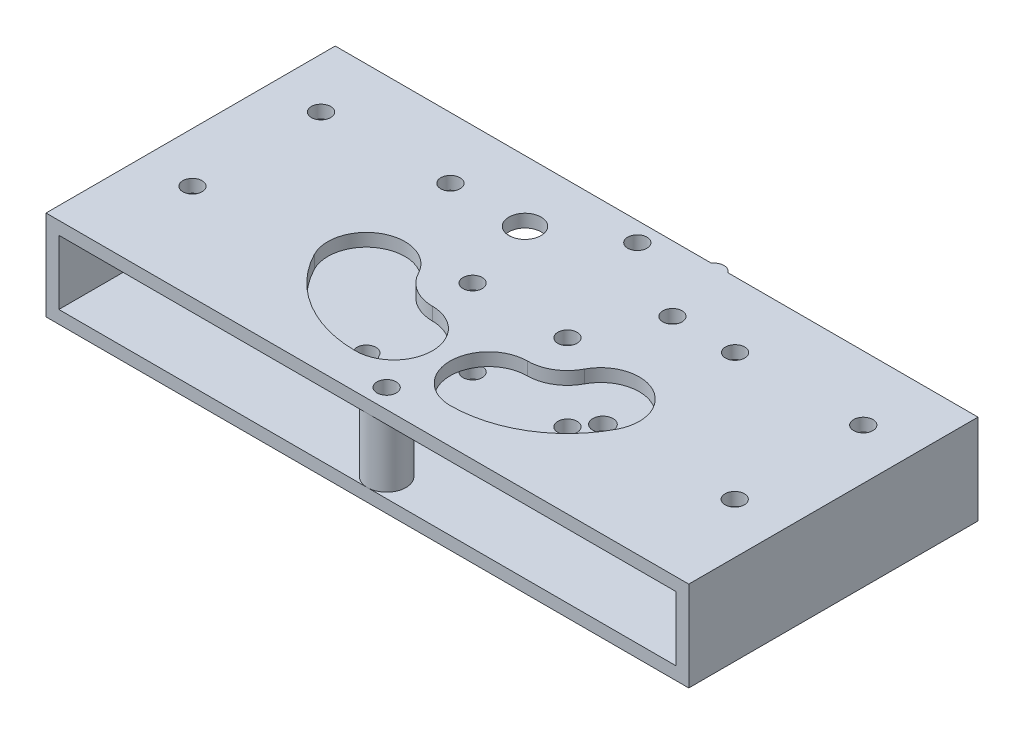
from build123d import *

# Parameters (mm, degrees)
SKETCH2_W           = 100
SKETCH2_H           = 40
BOSS_EXTRUDE5_DEPTH = 14
SHELL1_T            = -2
SKETCH3_6_R         = 2.5
SKETCH3_6_R_2       = 1.5
CUT_EXTRUDE8_DEPTH  = 56.641710973
CUT_EXTRUDE9_DEPTH  = 12
SKETCH5_W           = 100
SKETCH5_H           = 14
SKETCH5_W_2         = 96
SKETCH5_H_2         = 10
BOSS_EXTRUDE6_DEPTH = 5
SKETCH6_R           = 3
SKETCH6_R_2         = 1.5
SKETCH6_R_3         = 1.58
SKETCH6_R_4         = 1.95
BOSS_EXTRUDE7_DEPTH = 14
SKETCH6_2_R         = 1.5
CUT_EXTRUDE11_DEPTH = 58.628118137
CUT_EXTRUDE12_START = -2
SKETCH6_3_R         = 1.58
SKETCH6_3_R_2       = 1.95
CUT_EXTRUDE12_DEPTH = 56.628118137


with BuildPart() as part:
    # Sketch2 → Boss-Extrude5 (new body)
    with BuildSketch(Plane(origin=(0, 0, 0), x_dir=(1, 0, 0), z_dir=(0, 1, 0))):
        Rectangle(SKETCH2_W, SKETCH2_H)
    extrude(amount=BOSS_EXTRUDE5_DEPTH)

    # Shell1
    shell1_openings = [part.faces().sort_by_distance(p)[0] for p in [
        (0, 7, -20),
        (0, 7, 20),
    ]]
    offset(amount=SHELL1_T, openings=shell1_openings, kind=Kind.INTERSECTION)

    # Sketch3<6> → Cut-Extrude8 (cut, through all)
    with BuildSketch(Plane(origin=(0, 14, 0), x_dir=(1, 0, 0), z_dir=(0, 1, 0))):
        with Locations(Location((-10.944299399, 10.466797681, 0), (0, 0, 270))):
            Circle(SKETCH3_6_R)
        with Locations(Location((-42.214291858, -10, 0), (0, 0, 270))):
            Circle(SKETCH3_6_R_2)
        with Locations(Location((-42.214291858, 10, 0), (0, 0, 270))):
            Circle(SKETCH3_6_R_2)
        with Locations(Location((-22.547984959, 10.466797681, 0), (0, 0, 270))):
            Circle(SKETCH3_6_R_2)
        with Locations(Location((-7.3745, -1.251, 0), (0, 0, 270))):
            Circle(SKETCH3_6_R_2)
        with Locations(Location((7.3745, -1.251, 0), (0, 0, 270))):
            Circle(SKETCH3_6_R_2)
        with Locations(Location((12.650652812, 9.804528549, 0), (0, 0, 270))):
            Circle(SKETCH3_6_R_2)
        with Locations(Location((22.400652812, 9.804528549, 0), (0, 0, 270))):
            Circle(SKETCH3_6_R_2)
        with BuildLine():
            ThreePointArc((7.3745, -15), (14.495799481, -13.012041395), (19.557771218, -7.623040759))
            ThreePointArc((19.557771218, -7.623040759), (18.923772695, -5.598677681), (16.899409617, -6.232676204))
            ThreePointArc((16.899409617, -6.232676204), (12.941948405, -10.445809365), (7.3745, -12))
            ThreePointArc((7.3745, -12), (5.8745, -13.5), (7.3745, -15))
        make_face()
        with BuildLine():
            ThreePointArc((-7.3745, -15), (-14.495799481, -13.012041395), (-19.557771218, -7.623040759))
            ThreePointArc((-19.557771218, -7.623040759), (-18.923772695, -5.598677681), (-16.899409617, -6.232676204))
            ThreePointArc((-16.899409617, -6.232676204), (-12.941948405, -10.445809365), (-7.3745, -12))
            ThreePointArc((-7.3745, -12), (-5.8745, -13.5), (-7.3745, -15))
        make_face()
        with Locations(Location((42.150652812, 10, 0), (0, 0, 270))):
            Circle(SKETCH3_6_R_2)
        with Locations(Location((42.150652812, -10, 0), (0, 0, 270))):
            Circle(SKETCH3_6_R_2)
    extrude(amount=-CUT_EXTRUDE8_DEPTH, mode=Mode.SUBTRACT)

    # Sketch3 → Cut-Extrude9 (cut)
    # profile 1 of 2: a face of its own
    with BuildSketch(Plane(origin=(0, 14, 0), x_dir=(1, 0, 0), z_dir=(0, 1, 0))):
        with BuildLine():
            ThreePointArc((-23.545313619, -9.708587593), (-21.009319529, -1.611135279), (-12.911867215, -4.14712937))
            ThreePointArc((-12.911867215, -4.14712937), (-10.611171791, -6.596461319), (-7.3745, -7.5))
            ThreePointArc((-7.3745, -7.5), (-1.3745, -13.5), (-7.3745, -19.5))
            ThreePointArc((-7.3745, -19.5), (-16.826576095, -16.861389441), (-23.545313619, -9.708587593))
        make_face()
        with BuildLine():
            ThreePointArc((-7.3745, -15), (-14.495799481, -13.012041395), (-19.557771218, -7.623040759))
            ThreePointArc((-19.557771218, -7.623040759), (-18.923772695, -5.598677681), (-16.899409617, -6.232676204))
            ThreePointArc((-16.899409617, -6.232676204), (-12.941948405, -10.445809365), (-7.3745, -12))
            ThreePointArc((-7.3745, -12), (-5.8745, -13.5), (-7.3745, -15))
        make_face(mode=Mode.SUBTRACT)
    # profile 2 of 2: a face of its own
    with BuildSketch(Plane(origin=(0, 14, 0), x_dir=(1, 0, 0), z_dir=(0, 1, 0))):
        with BuildLine():
            ThreePointArc((7.3745, -19.5), (16.826576095, -16.861389441), (23.545313619, -9.708587593))
            ThreePointArc((23.545313619, -9.708587593), (21.009319529, -1.611135279), (12.911867215, -4.14712937))
            ThreePointArc((12.911867215, -4.14712937), (10.611171791, -6.596461319), (7.3745, -7.5))
            ThreePointArc((7.3745, -7.5), (1.3745, -13.5), (7.3745, -19.5))
        make_face()
        with BuildLine():
            ThreePointArc((19.557771218, -7.623040759), (18.923772695, -5.598677681), (16.899409617, -6.232676204))
            ThreePointArc((16.899409617, -6.232676204), (12.941948405, -10.445809365), (7.3745, -12))
            ThreePointArc((7.3745, -12), (5.8745, -13.5), (7.3745, -15))
            ThreePointArc((7.3745, -15), (14.495799481, -13.012041395), (19.557771218, -7.623040759))
        make_face(mode=Mode.SUBTRACT)
    extrude(amount=-CUT_EXTRUDE9_DEPTH, mode=Mode.SUBTRACT)

    # Sketch5 → Boss-Extrude6 (add)
    with BuildSketch(Plane.XY.offset(20)):
        with Locations((0, 7)):
            Rectangle(SKETCH5_W, SKETCH5_H)
        with Locations((0, 7)):
            Rectangle(SKETCH5_W_2, SKETCH5_H_2, mode=Mode.SUBTRACT)
    extrude(amount=BOSS_EXTRUDE6_DEPTH)

    # Sketch6 → Boss-Extrude7 (add, through all)
    # profile 1 of 5: a face of its own
    with BuildSketch(Plane(origin=(0, 14, 0), x_dir=(1, 0, 0), z_dir=(0, 1, 0))):
        with Locations(Location((0, 17, 0), (0, 0, 90))):
            Circle(SKETCH6_R)
        with Locations(Location((0, 17, 0), (0, 0, 270))):
            Circle(SKETCH6_R_2, mode=Mode.SUBTRACT)
    # profile 2 of 5: a face of its own
    with BuildSketch(Plane(origin=(0, 14, 0), x_dir=(1, 0, 0), z_dir=(0, 1, 0))):
        with Locations(Location((0, -22, 0), (0, 0, 270))):
            Circle(SKETCH6_R)
        with Locations(Location((0, -22, 0), (0, 0, 270))):
            Circle(SKETCH6_R_2, mode=Mode.SUBTRACT)
    # profile 3 of 5: a face of its own
    with BuildSketch(Plane(origin=(0, 14, 0), x_dir=(1, 0, 0), z_dir=(0, 1, 0))):
        with Locations(Location((9.804442129, 19.091797681, 0), (0, 0, 144.913560917))):
            Circle(SKETCH6_R_3)
    # profile 4 of 5: a face of its own
    with BuildSketch(Plane(origin=(0, 14, 0), x_dir=(1, 0, 0), z_dir=(0, 1, 0))):
        with Locations(Location((9.804442129, 1.841797681, 0), (0, 0, 270))):
            Circle(SKETCH6_R_3)
    # profile 5 of 5: a face of its own
    with BuildSketch(Plane(origin=(0, 14, 0), x_dir=(1, 0, 0), z_dir=(0, 1, 0))):
        with Locations(Location((-0.944299399, 10.466797681, 0), (0, 0, 270))):
            Circle(SKETCH6_R_4)
    extrude(amount=-BOSS_EXTRUDE7_DEPTH)

    # Sketch6<2> → Cut-Extrude11 (cut, through all)
    with BuildSketch(Plane(origin=(0, 14, 0), x_dir=(1, 0, 0), z_dir=(0, 1, 0))):
        with Locations(Location((0, -22, 0), (0, 0, 270))):
            Circle(SKETCH6_2_R)
        with Locations(Location((0, 17, 0), (0, 0, 270))):
            Circle(SKETCH6_2_R)
    extrude(amount=-CUT_EXTRUDE11_DEPTH, mode=Mode.SUBTRACT)

    # Sketch6<3> → Cut-Extrude12 (cut, through all)
    with BuildSketch(Plane(origin=(0, 14, 0), x_dir=(1, 0, 0), z_dir=(0, 1, 0)).offset(CUT_EXTRUDE12_START)):
        with Locations((9.804442129, 19.091797681)):
            Circle(SKETCH6_3_R)
        with Locations(Location((9.804442129, 1.841797681, 0), (0, 0, 270))):
            Circle(SKETCH6_3_R)
        with Locations(Location((-0.944299399, 10.466797681, 0), (0, 0, 270))):
            Circle(SKETCH6_3_R_2)
    extrude(amount=-CUT_EXTRUDE12_DEPTH, mode=Mode.SUBTRACT)


solid = part.part
